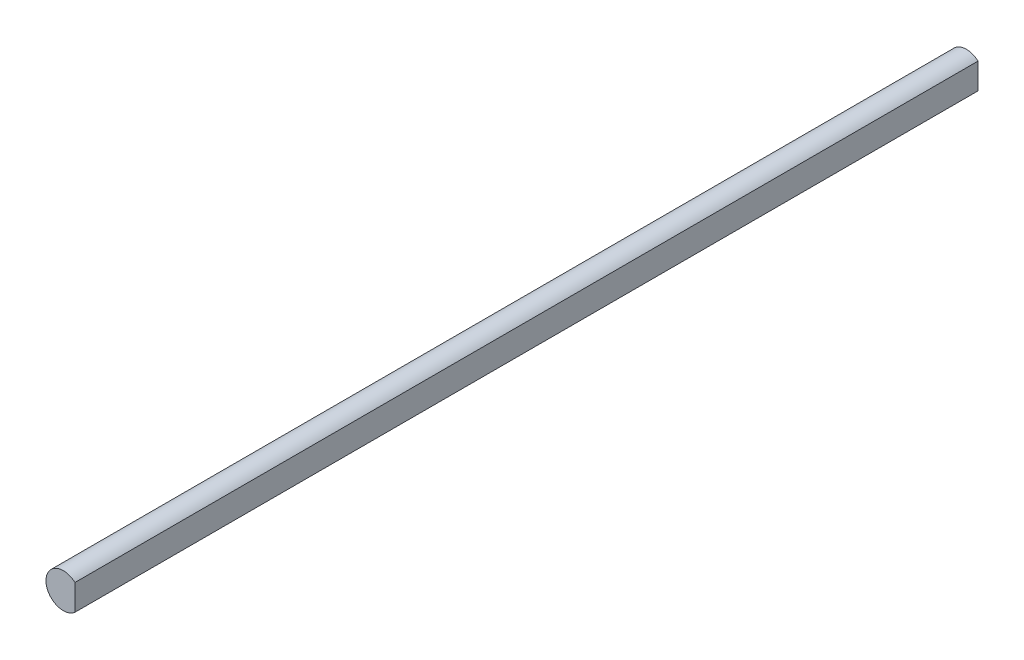
from build123d import *

# Parameters (mm, degrees)
CROQUIS1_R              = 2.5
SALIENTE_EXTRUIR1_DEPTH = 130
CORTAR_EXTRUIR1_DEPTH   = 131.048068036


with BuildPart() as part:
    # Croquis1 → Saliente-Extruir1 (new body)
    with BuildSketch(Plane.XY):
        Circle(CROQUIS1_R)
    extrude(amount=SALIENTE_EXTRUIR1_DEPTH)

    # Croquis2 → Cortar-Extruir1 (cut, through all)
    with BuildSketch(Plane(origin=(0, 0, 0), x_dir=(-1, 0, 0), z_dir=(0, 0, -1))):
        with BuildLine():
            Line((-1.672910403, 1.857786528), (-1.672910403, -1.857786528))
            ThreePointArc((-1.672910403, -1.857786528), (-2.5, 0), (-1.672910403, 1.857786528))
        make_face()
    extrude(amount=-CORTAR_EXTRUIR1_DEPTH, mode=Mode.SUBTRACT)


solid = part.part
